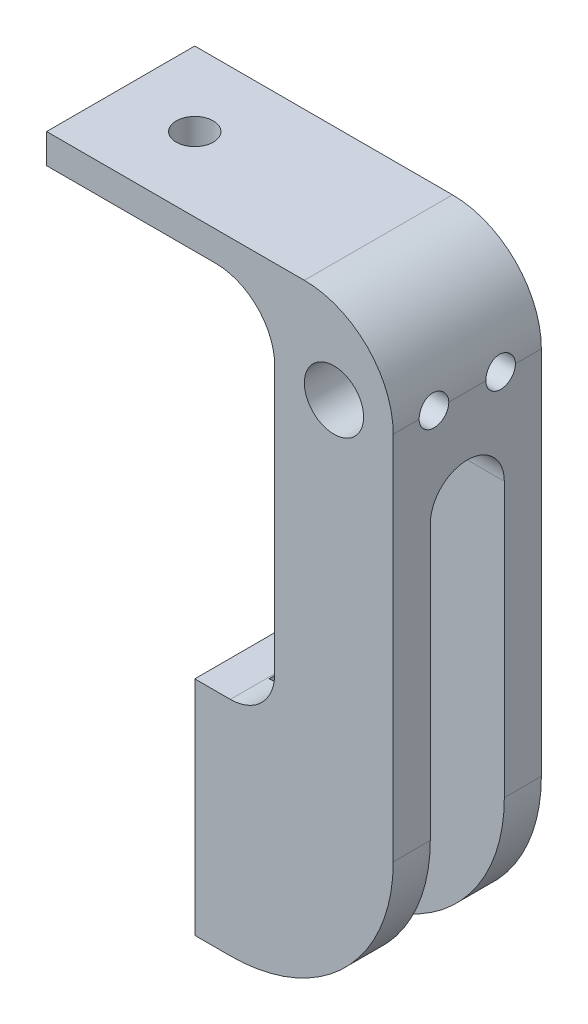
from build123d import *

# Parameters (mm, degrees)
SKETCH1_R           = 4
SKETCH1_R_2         = 2
BOSS_EXTRUDE1_DEPTH = 25
SKETCH2_W           = 20
SKETCH2_H           = 20
CUT_EXTRUDE1_DEPTH  = 30
SKETCH3_R           = 2.5
CUT_EXTRUDE2_DEPTH  = 25
SKETCH6_W           = 100
SKETCH6_H           = 150
CUT_EXTRUDE5_DEPTH  = 5
CUT_EXTRUDE6_DEPTH  = 21.8
SKETCH8_R           = 2
CUT_EXTRUDE7_DEPTH  = 21.8
SKETCH9_R           = 2
CUT_EXTRUDE8_DEPTH  = 6


with BuildPart() as part:
    # Sketch1 → Boss-Extrude1 (new body)
    with BuildSketch(Plane.XY):
        with BuildLine():
            Line((-10, 25), (12.8, 25))
            ThreePointArc((12.8, 25), (18.456854249, 22.656854249), (20.8, 17))
            Line((20.8, 17), (20.8, -19))
            ThreePointArc((20.8, -19), (19.042640687, -23.242640687), (14.8, -25))
            Line((14.8, -25), (-10, -25))
            Line((-10, -25), (-10, -55))
            Line((-10, -55), (14.8, -55))
            ThreePointArc((14.8, -55), (30.356349186, -48.556349186), (36.8, -33))
            Line((36.8, -33), (36.8, 17))
            ThreePointArc((36.8, 17), (33.285281374, 25.485281374), (24.8, 29))
            Line((24.8, 29), (-10, 29))
            Line((-10, 29), (-10, 25))
        make_face()
        with Locations((28.8, 17)):
            Circle(SKETCH1_R, mode=Mode.SUBTRACT)
        with Locations((0, -35)):
            Circle(SKETCH1_R_2, mode=Mode.SUBTRACT)
    extrude(amount=BOSS_EXTRUDE1_DEPTH)

    # Sketch2 → Cut-Extrude1 (cut)
    with BuildSketch(Plane(origin=(0, -25, 0), x_dir=(1, 0, 0), z_dir=(0, 1, 0))):
        with Locations((0, -10)):
            Rectangle(SKETCH2_W, SKETCH2_H)
    extrude(amount=-CUT_EXTRUDE1_DEPTH, mode=Mode.SUBTRACT)

    # Sketch3 → Cut-Extrude2 (cut)
    with BuildSketch(Plane(origin=(0, 29, 0), x_dir=(1, 0, 0), z_dir=(0, 1, 0))):
        with Locations(Location((0, -10, 0), (0, 0, 180))):
            Circle(SKETCH3_R)
    extrude(amount=-CUT_EXTRUDE2_DEPTH, mode=Mode.SUBTRACT)

    # Sketch6 → Cut-Extrude5 (cut)
    with BuildSketch(Plane.XY.offset(25)):
        Rectangle(SKETCH6_W, SKETCH6_H)
    extrude(amount=-CUT_EXTRUDE5_DEPTH, mode=Mode.SUBTRACT)

    # Sketch7 → Cut-Extrude6 (cut)
    with BuildSketch(Plane(origin=(36.8, 0, 0), x_dir=(0, 0, -1), z_dir=(1, 0, 0))):
        with BuildLine():
            Line((-5, 4), (-5, -56))
            ThreePointArc((-5, -56), (-10, -61), (-15, -56))
            Line((-15, -56), (-15, 4))
            ThreePointArc((-15, 4), (-10, 9), (-5, 4))
        make_face()
    extrude(amount=-CUT_EXTRUDE6_DEPTH, mode=Mode.SUBTRACT)

    # Sketch8 → Cut-Extrude7 (cut)
    with BuildSketch(Plane(origin=(15, 0, 0), x_dir=(0, 0, -1), z_dir=(1, 0, 0))):
        with Locations(Location((-10, -31.99666574, 0), (0, 0, 90))):
            Circle(SKETCH8_R)
        with Locations(Location((-10, -47.99909089, 0), (0, 0, 90))):
            Circle(SKETCH8_R)
    extrude(amount=-CUT_EXTRUDE7_DEPTH, mode=Mode.SUBTRACT)

    # Sketch9 → Cut-Extrude8 (cut)
    with BuildSketch(Plane(origin=(36.8, 0, 0), x_dir=(0, 0, -1), z_dir=(1, 0, 0))):
        with Locations(Location((-14.5, 17, 0), (0, 0, 90))):
            Circle(SKETCH9_R)
        with Locations(Location((-5.5, 17, 0), (0, 0, 90))):
            Circle(SKETCH9_R)
    extrude(amount=-CUT_EXTRUDE8_DEPTH, mode=Mode.SUBTRACT)


solid = part.part
